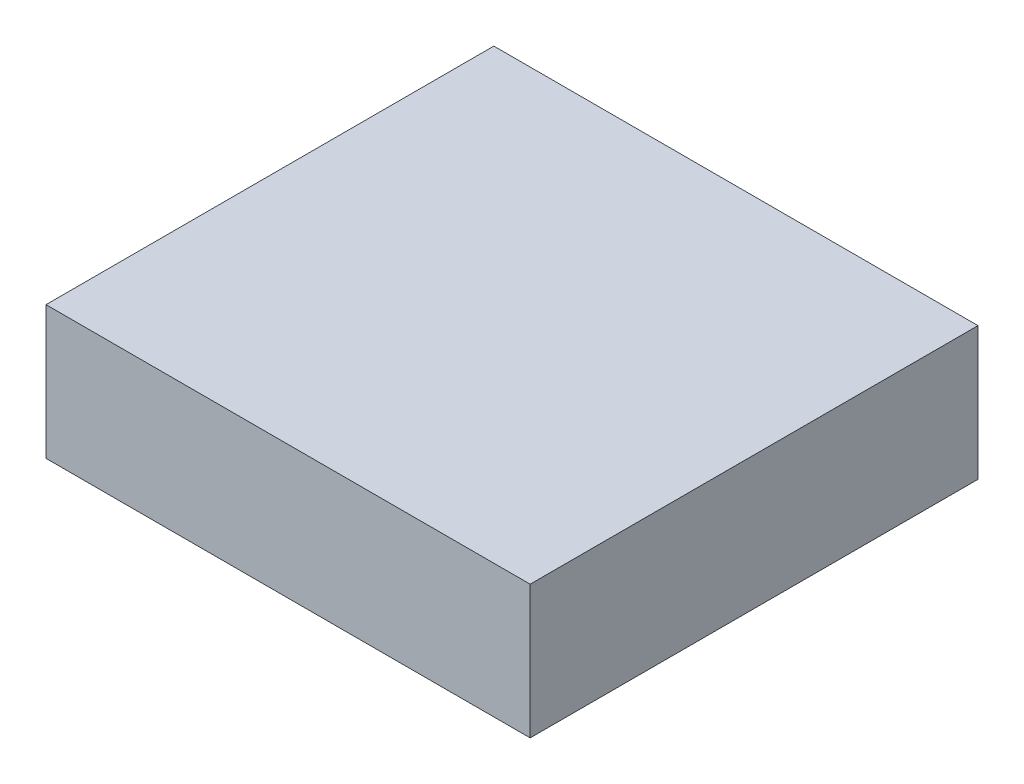
from build123d import *

# Parameters (mm, degrees)
SKETCH1_W           = 101.6
SKETCH1_H           = 93.98
BOSS_EXTRUDE1_DEPTH = 27.94


with BuildPart() as part:
    # Sketch1 → Boss-Extrude1 (new body)
    with BuildSketch(Plane(origin=(0, 0, 0), x_dir=(1, 0, 0), z_dir=(0, 1, 0))):
        Rectangle(SKETCH1_W, SKETCH1_H)
    extrude(amount=BOSS_EXTRUDE1_DEPTH)


solid = part.part
